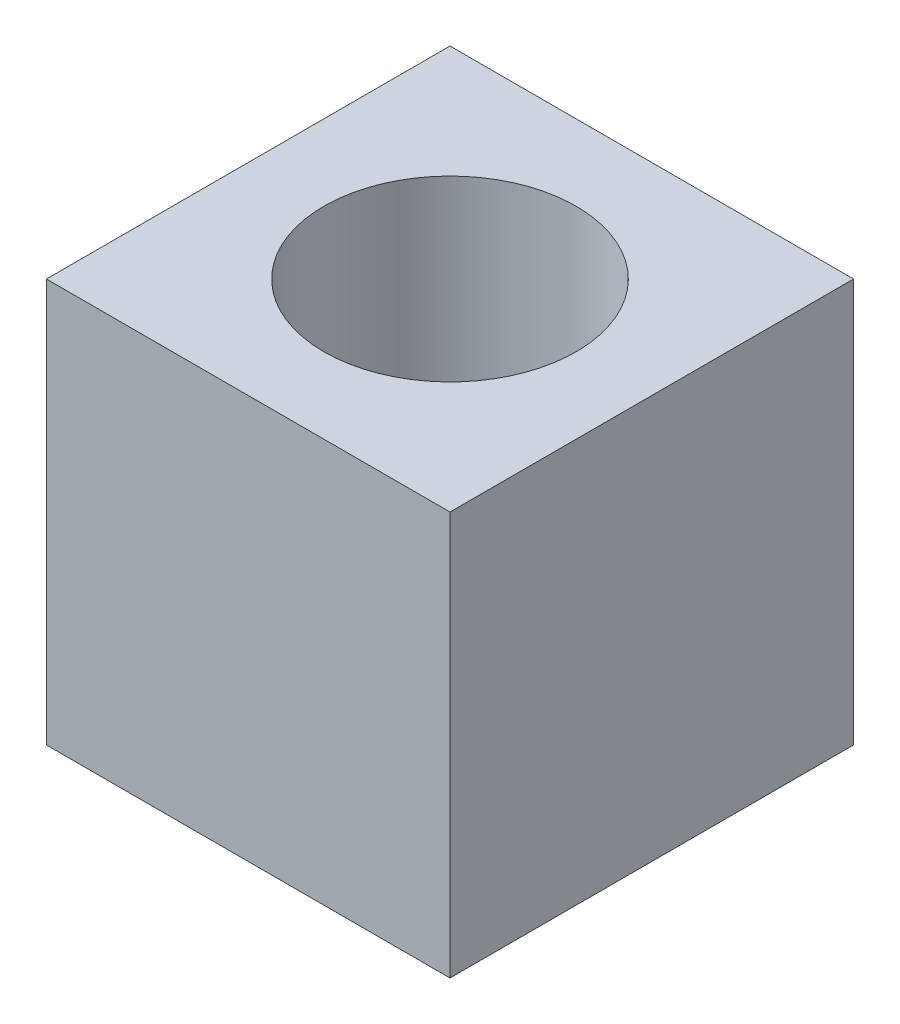
from build123d import *

# Parameters (mm, degrees)
SKETCH1_W               = 40
SKETCH1_H               = 40
BOSS_EXTRUDE1_DEPTH     = 20
CUT_EXTRUDE2_DEPTH      = 35.641016151
CUT_EXTRUDE2_DEPTH_BACK = 35.641016151
SKETCH2_R               = 12.5


with BuildPart() as part:
    # Sketch1 → Boss-Extrude1 (new, symmetric)
    with BuildSketch(Plane.XY):
        Rectangle(SKETCH1_W, SKETCH1_H)
    extrude(amount=BOSS_EXTRUDE1_DEPTH, both=True)

    # Sketch2 → Cut-Extrude2 (cut, two sides: drawn at the far end of the back side and taken through both)
    with BuildSketch(Plane.ZX.offset(-CUT_EXTRUDE2_DEPTH_BACK)):
        Circle(SKETCH2_R)
    extrude(amount=CUT_EXTRUDE2_DEPTH + CUT_EXTRUDE2_DEPTH_BACK, mode=Mode.SUBTRACT)


solid = part.part
